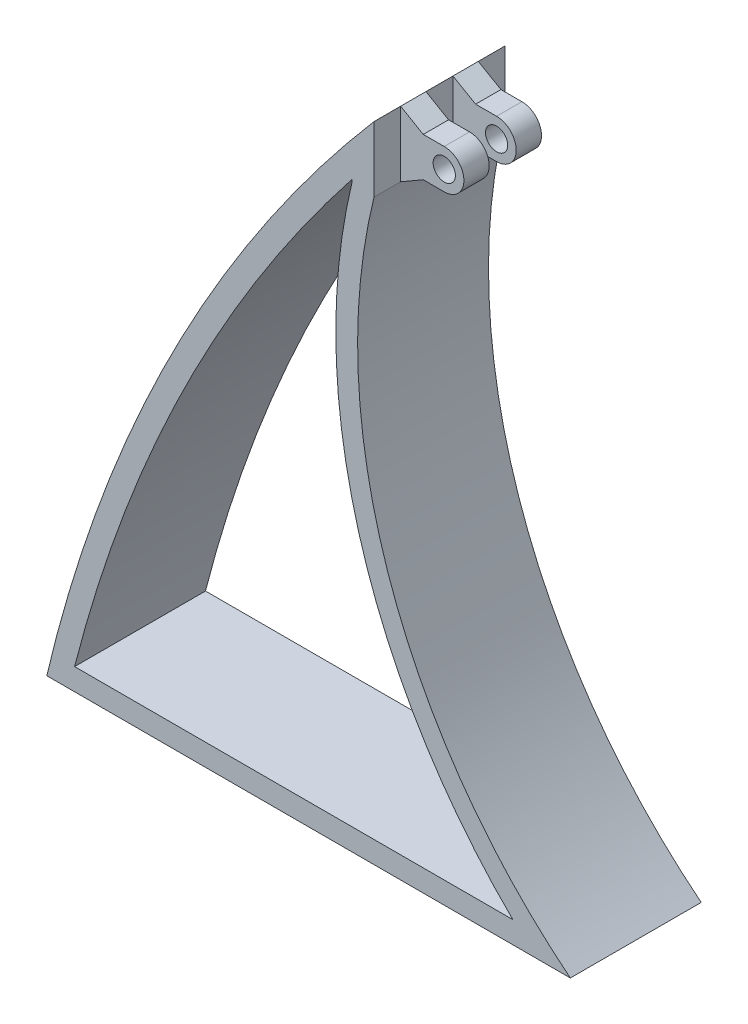
from build123d import *

# Parameters (mm, degrees)
BOSS_EXTRUDE1_DEPTH = 15
CUT_EXTRUDE1_DEPTH  = 163.037804231
BOSS_EXTRUDE2_START = 3.1
SKETCH4_R           = 2.55
BOSS_EXTRUDE2_DEPTH = 5.8


with BuildPart() as part:
    # Sketch1 → Boss-Extrude1 (new, symmetric)
    with BuildSketch(Plane.XY):
        with BuildLine():
            Line((-60, 0), (60, 0))
            ThreePointArc((60, 0), (18.151331496, 59.678754093), (15, 132.5))
            Line((15, 132.5), (15, 147.5))
            ThreePointArc((15, 147.5), (-31.342172096, 78.24601971), (-60, 0))
        make_face()
    extrude(amount=BOSS_EXTRUDE1_DEPTH, both=True)

    # Sketch3 → Cut-Extrude1 (cut, through all)
    with BuildSketch(Plane.XY.offset(15)):
        with BuildLine():
            Line((10, 133.099398757), (10, 133.566618733))
            ThreePointArc((10, 133.566618733), (-28.567393604, 72.626562232), (-53.622980136, 5))
            Line((-53.622980136, 5), (46.822703911, 5))
            ThreePointArc((46.822703911, 5), (11.500002428, 64.188461758), (10, 133.099398757))
        make_face()
    extrude(amount=-CUT_EXTRUDE1_DEPTH, mode=Mode.SUBTRACT)

    # Sketch4 → Boss-Extrude2 (add)
    with BuildSketch(Plane.XY.offset(BOSS_EXTRUDE2_START)):
        with BuildLine():
            Line((25, 135.5), (20.196152423, 135.5))
            Line((20.196152423, 135.5), (15, 132.5))
            Line((15, 132.5), (15, 147.5))
            Line((15, 147.5), (20.196152423, 144.5))
            Line((20.196152423, 144.5), (25, 144.5))
            ThreePointArc((25, 144.5), (29.5, 140), (25, 135.5))
        make_face()
        with Locations((25, 140)):
            Circle(SKETCH4_R, mode=Mode.SUBTRACT)
    boss_extrude2 = extrude(amount=BOSS_EXTRUDE2_DEPTH)

    # Mirror1: Boss-Extrude2 across plane
    add(boss_extrude2.mirror(Plane.XY))


solid = part.part
